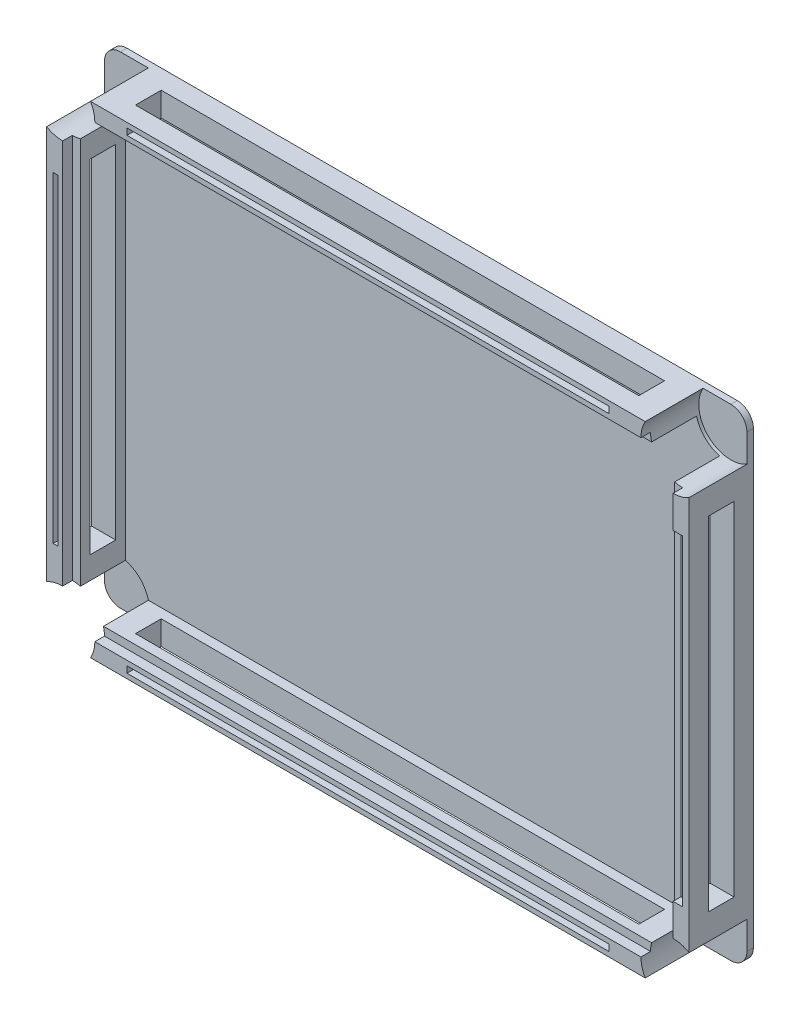
from build123d import *

# Parameters (mm, degrees)
ESBO_O1_W                = 200
ESBO_O1_H                = 150
RESSALTO_EXTRUS_O1_DEPTH = 20
ESBO_O4_W                = 185
ESBO_O4_H                = 135
CORTE_EXTRUS_O2_DEPTH    = 17
ESBO_O3_W                = 190
ESBO_O3_H                = 140
CORTE_EXTRUS_O3_DEPTH    = 3
ESBO_O6_R                = 10
CORTE_EXTRUS_O4_DEPTH    = 18
FILETE4_R                = 5
FILETE5_R                = 5
FILETE6_R                = 5
FILETE7_R                = 5
ESBO_O7_W                = 156.679491924
ESBO_O7_H                = 8
CORTE_EXTRUS_O5_DEPTH    = 300
ESBO_O8_W                = 8
ESBO_O8_H                = 106.679491924
CORTE_EXTRUS_O6_DEPTH    = 300
ESBO_O15_W               = 1.5
ESBO_O15_H               = 100
ESBO_O15_W_2             = 150
ESBO_O15_H_2             = 2
ESBO_O15_W_3             = 3.5
CORTE_EXTRUS_O7_DEPTH    = 2.5


with BuildPart() as part:
    # Esboço1 → Ressalto-extrusão1 (new body)
    with BuildSketch(Plane.XY):
        Rectangle(ESBO_O1_W, ESBO_O1_H)
    extrude(amount=RESSALTO_EXTRUS_O1_DEPTH)

    # Esboço4 → Corte-extrusão2 (cut)
    with BuildSketch(Plane.XY.offset(20)):
        Rectangle(ESBO_O4_W, ESBO_O4_H)
    extrude(amount=-CORTE_EXTRUS_O2_DEPTH, mode=Mode.SUBTRACT)

    # Esboço3 → Corte-extrusão3 (cut)
    with BuildSketch(Plane.XY.offset(20)):
        Rectangle(ESBO_O3_W, ESBO_O3_H)
    extrude(amount=-CORTE_EXTRUS_O3_DEPTH, mode=Mode.SUBTRACT)

    # Esboço6 → Corte-extrusão4 (cut)
    with BuildSketch(Plane.XY.offset(20)):
        with Locations((-95, 70)):
            Circle(ESBO_O6_R)
        with Locations((95, 70)):
            Circle(ESBO_O6_R)
        with Locations((-95, -70)):
            Circle(ESBO_O6_R)
        with Locations((95, -70)):
            Circle(ESBO_O6_R)
    extrude(amount=-CORTE_EXTRUS_O4_DEPTH, mode=Mode.SUBTRACT)

    # Filete4
    filete4_edges = [part.edges().sort_by_distance(p)[0] for p in [
        (-100, 75, 1),
    ]]
    fillet(filete4_edges, radius=FILETE4_R)

    # Filete5
    filete5_edges = [part.edges().sort_by_distance(p)[0] for p in [
        (100, 75, 1),
    ]]
    fillet(filete5_edges, radius=FILETE5_R)

    # Filete6
    filete6_edges = [part.edges().sort_by_distance(p)[0] for p in [
        (100, -75, 1),
    ]]
    fillet(filete6_edges, radius=FILETE6_R)

    # Filete7
    filete7_edges = [part.edges().sort_by_distance(p)[0] for p in [
        (-100, -75, 1),
    ]]
    fillet(filete7_edges, radius=FILETE7_R)

    # Esboço7 → Corte-extrusão5 (cut)
    with BuildSketch(Plane.XZ.offset(75)):
        with Locations((0, 10)):
            Rectangle(ESBO_O7_W, ESBO_O7_H)
    extrude(amount=-CORTE_EXTRUS_O5_DEPTH, mode=Mode.SUBTRACT)

    # Esboço8 → Corte-extrusão6 (cut)
    with BuildSketch(Plane.ZY.offset(100)):
        with Locations((10, 0)):
            Rectangle(ESBO_O8_W, ESBO_O8_H)
    extrude(amount=-CORTE_EXTRUS_O6_DEPTH, mode=Mode.SUBTRACT)

    # Esboço15 → Corte-extrusão7 (cut)
    with BuildSketch(Plane.XY.offset(20)):
        with Locations((-97.25, 0)):
            Rectangle(ESBO_O15_W, ESBO_O15_H)
        with Locations((0, 72.5)):
            Rectangle(ESBO_O15_W_2, ESBO_O15_H_2)
        with Locations((0, -72.5)):
            Rectangle(ESBO_O15_W_2, ESBO_O15_H_2)
        with Locations((96.25, 0)):
            Rectangle(ESBO_O15_W_3, ESBO_O15_H)
    extrude(amount=-CORTE_EXTRUS_O7_DEPTH, mode=Mode.SUBTRACT)


solid = part.part
